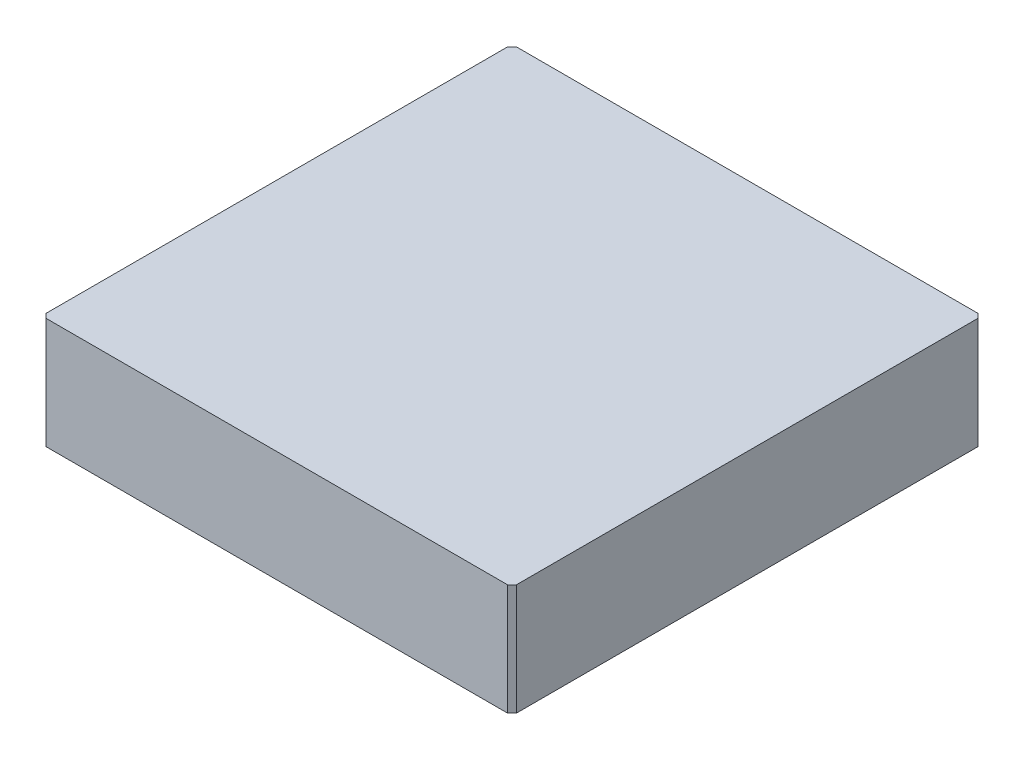
from build123d import *

# Parameters (mm, degrees)
SKETCH_1_W      = 110
SKETCH_1_H      = 110
EXTRUDE_1_DEPTH = 26
CHAMFER_1_SIZE  = 1


with BuildPart() as part:
    # 草图1 → 凸台-拉伸1 (new body)
    with BuildSketch(Plane(origin=(0, 0, 0), x_dir=(1, 0, 0), z_dir=(0, 1, 0))):
        Rectangle(SKETCH_1_W, SKETCH_1_H)
    extrude(amount=EXTRUDE_1_DEPTH)

    # 倒角1
    chamfer_1_edges = [part.edges().sort_by_distance(p)[0] for p in [
        (55, 13, 55),
        (-55, 13, 55),
        (-55, 13, -55),
        (55, 13, -55),
    ]]
    chamfer(chamfer_1_edges, length=CHAMFER_1_SIZE)


solid = part.part
